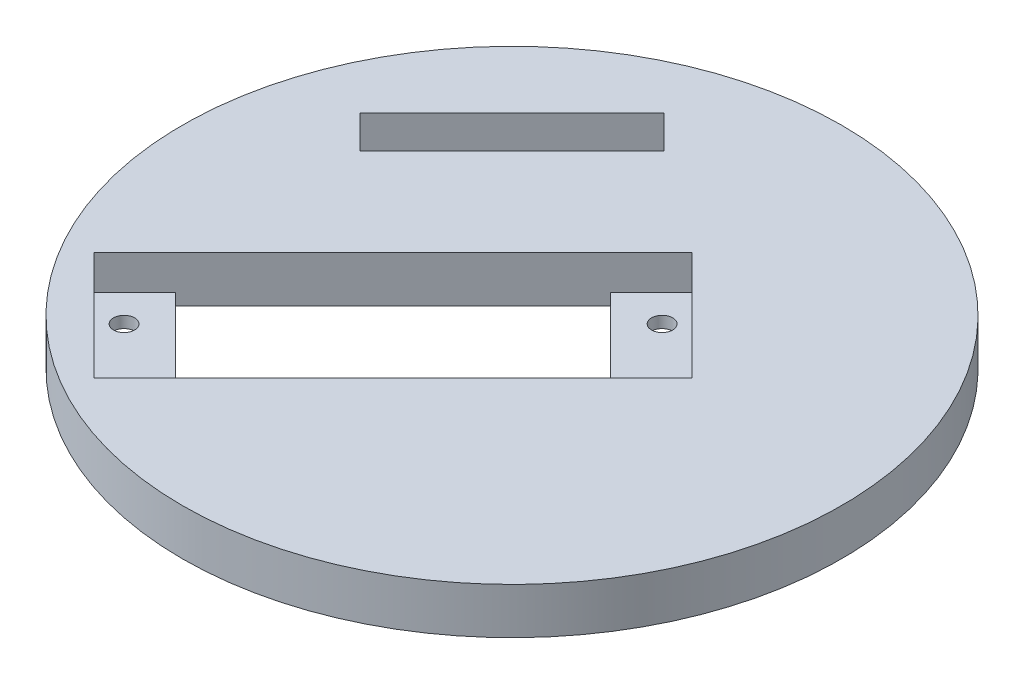
from build123d import *

# Parameters (mm, degrees)
SKETCH1_R           = 42.875795621
BOSS_EXTRUDE1_DEPTH = 6
BOSS_EXTRUDE2_DEPTH = 1.5
CUT_EXTRUDE1_REACH  = 62.932
CUT_EXTRUDE2_DEPTH  = 4
CIRPATTERN1_COUNT   = 4
CUT_EXTRUDE3_REACH  = 62.802
SKETCH5_R           = 1.375


with BuildPart() as part:
    # Sketch1 → Boss-Extrude1 (new body)
    with BuildSketch(Plane(origin=(0, 0, 0), x_dir=(1, 0, 0), z_dir=(0, 1, 0))):
        with Locations(Location((0, 0, 0), (0, 0, 270))):
            Circle(SKETCH1_R)
        Polygon((-20.109572639, -34.251708263), (-34.251708263, -20.109572639), (4.639164702, 18.781300326), (18.781300326, 4.639164702), align=None, mode=Mode.SUBTRACT)
    extrude(amount=BOSS_EXTRUDE1_DEPTH)

    # Sketch1<4> → Boss-Extrude2 (add)
    with BuildSketch(Plane(origin=(0, 0, 0), x_dir=(1, 0, 0), z_dir=(0, 1, 0))):
        Polygon((18.781300326, 4.639164702), (4.639164702, 18.781300326), (-0.664136157, 13.477999467), (13.477999467, -0.664136157), align=None)
        Polygon((-14.80627178, -28.948407404), (-28.948407404, -14.80627178), (-34.251708263, -20.109572639), (-20.109572639, -34.251708263), align=None)
    extrude(amount=BOSS_EXTRUDE2_DEPTH)

    # Sketch2 → Cut-Extrude1 (cut, up to next)
    with BuildSketch(Plane(origin=(0, 6, 0), x_dir=(1, 0, 0), z_dir=(0, 1, 0)), mode=Mode.PRIVATE) as cut_extrude1_sk1:
        Polygon((-32.676453, 12.877463126), (-12.877463126, 32.676453), (-8.634822439, 28.433812313), (-28.433812313, 8.634822439), align=None)
    cut_extrude1_tool1 = extrude(cut_extrude1_sk1.sketch, amount=-CUT_EXTRUDE1_REACH, mode=Mode.PRIVATE) & part.part
    add(cut_extrude1_tool1.solids().sort_by_distance((-20.655638, 6, -20.655638))[0], mode=Mode.SUBTRACT)

    # Sketch3 → Cut-Extrude2 (cut)
    with BuildSketch(Plane.XZ):
        with BuildLine():
            Line((-39.625795621, -2.5), (-39.625795621, 2.5))
            ThreePointArc((-39.625795621, 2.5), (-38.875795621, 3.25), (-38.125795621, 2.5))
            Line((-38.125795621, 2.5), (-38.125795621, -2.5))
            ThreePointArc((-38.125795621, -2.5), (-38.875795621, -3.25), (-39.625795621, -2.5))
        make_face()
    cut_extrude2 = extrude(amount=-CUT_EXTRUDE2_DEPTH, mode=Mode.SUBTRACT)

    # CirPattern1: Cut-Extrude2 ×4 about axis
    cirpattern1_axis = Axis((0, 0, 0), (0, 1, 0))
    for i in range(1, CIRPATTERN1_COUNT):
        add(cut_extrude2.rotate(cirpattern1_axis, i * 360 / CIRPATTERN1_COUNT), mode=Mode.SUBTRACT)

    # Sketch5 → Cut-Extrude3 (cut, up to next)
    with BuildSketch(Plane(origin=(0, 1.5, 0), x_dir=(1, 0, 0), z_dir=(0, 1, 0)), mode=Mode.PRIVATE) as cut_extrude3_sk1:
        with Locations(Location((13.301222772, 6.23015496, 0), (0, 0, 270))):
            Circle(SKETCH5_R)
    cut_extrude3_tool1 = extrude(cut_extrude3_sk1.sketch, amount=-CUT_EXTRUDE3_REACH, mode=Mode.PRIVATE) & part.part
    # Sketch5 → Cut-Extrude3 (cut, up to next)
    with BuildSketch(Plane(origin=(0, 1.5, 0), x_dir=(1, 0, 0), z_dir=(0, 1, 0)), mode=Mode.PRIVATE) as cut_extrude3_sk2:
        with Locations(Location((6.23015496, 13.301222772, 0), (0, 0, 270))):
            Circle(SKETCH5_R)
    cut_extrude3_tool2 = extrude(cut_extrude3_sk2.sketch, amount=-CUT_EXTRUDE3_REACH, mode=Mode.PRIVATE) & part.part
    cut_extrude3_1 = cut_extrude3_tool1.solids().sort_by_distance((13.301223, 1.5, -6.230155))[0]
    add(cut_extrude3_1, mode=Mode.SUBTRACT)
    cut_extrude3_2 = cut_extrude3_tool2.solids().sort_by_distance((6.230155, 1.5, -13.301223))[0]
    add(cut_extrude3_2, mode=Mode.SUBTRACT)
    cut_extrude3 = cut_extrude3_1 + cut_extrude3_2  # Cut-Extrude3 as one shape, for the pattern or mirror that repeats it

    # Mirror1: Cut-Extrude3 across plane
    add(cut_extrude3.mirror(Plane(origin=(-7.735203969, 0, 7.735203969), x_dir=(0.7071067811865474, 0, 0.7071067811865478), z_dir=(-0.7071067811865479, 0, 0.7071067811865472))), mode=Mode.SUBTRACT)


solid = part.part
